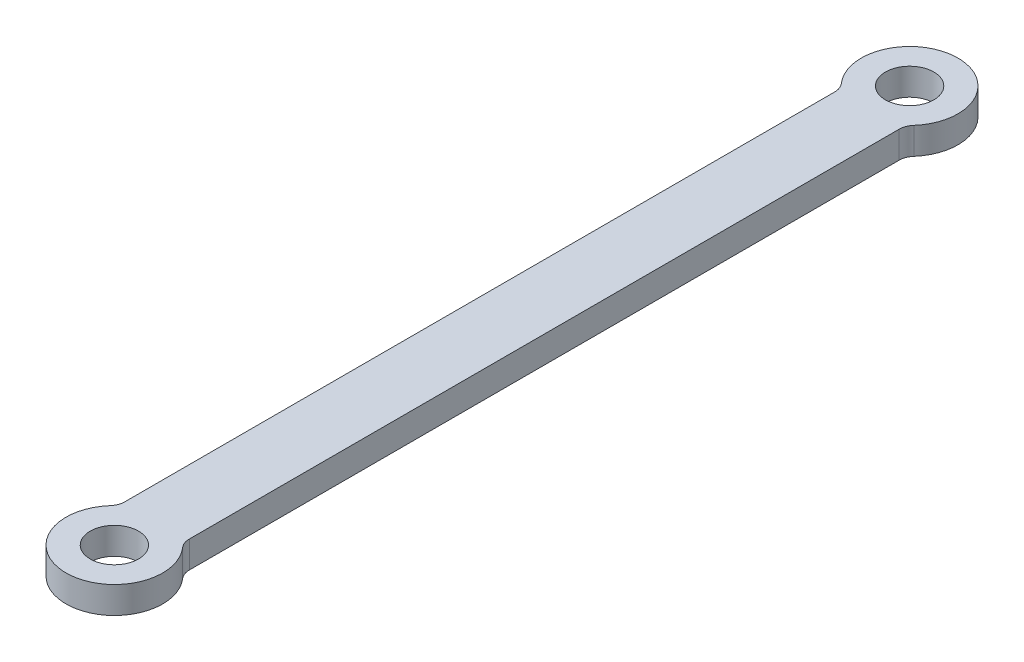
from build123d import *

# Parameters (mm, degrees)
SKETCH_1_R      = 4.5
EXTRUDE_1_DEPTH = 5


with BuildPart() as part:
    # 草图1 → 凸台-拉伸1 (new body)
    with BuildSketch(Plane(origin=(0, 0, 0), x_dir=(1, 0, 0), z_dir=(0, 1, 0))):
        with BuildLine():
            Line((-85.430894309, 43.501770457), (-85.430894309, -88.623721677))
            ThreePointArc((-85.430894309, -88.623721677), (-85.624651269, -89.684381848), (-86.180894309, -90.60803516))
            ThreePointArc((-86.180894309, -90.60803516), (-79.430894309, -105.56097561), (-72.680894309, -90.60803516))
            ThreePointArc((-72.680894309, -90.60803516), (-73.237137349, -89.684381848), (-73.430894309, -88.623721677))
            Line((-73.430894309, -88.623721677), (-73.430894309, 43.501770457))
            ThreePointArc((-73.430894309, 43.501770457), (-73.237137349, 44.562430629), (-72.680894309, 45.48608394))
            ThreePointArc((-72.680894309, 45.48608394), (-79.430894309, 60.43902439), (-86.180894309, 45.48608394))
            ThreePointArc((-86.180894309, 45.48608394), (-85.624651269, 44.562430629), (-85.430894309, 43.501770457))
        make_face()
        with Locations(Location((-79.430894309, 51.43902439, 0), (0, 0, 270))):
            Circle(SKETCH_1_R, mode=Mode.SUBTRACT)
        with Locations(Location((-79.430894309, -96.56097561, 0), (0, 0, 270))):
            Circle(SKETCH_1_R, mode=Mode.SUBTRACT)
    extrude(amount=EXTRUDE_1_DEPTH)


solid = part.part
